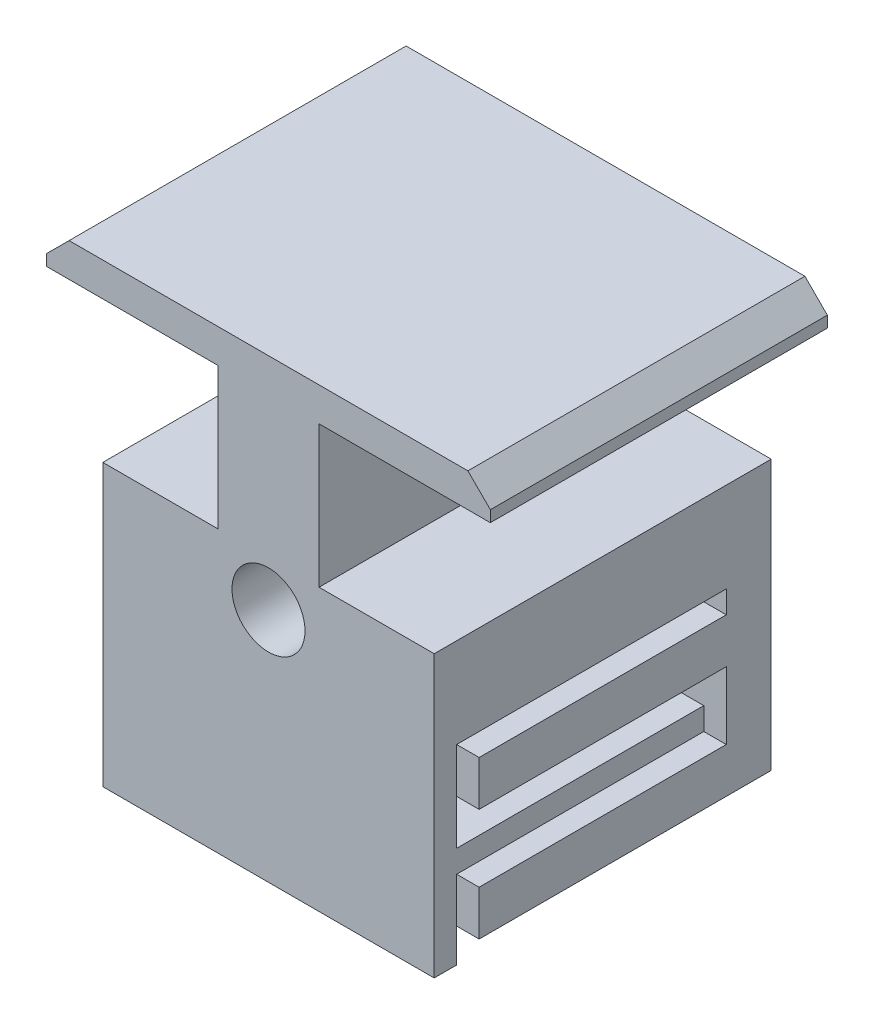
from build123d import *

# Parameters (mm, degrees)
BOSS_EXTRUDE1_DEPTH          = 30
SKETCH2_R                    = 3.25
CUT_EXTRUDE1_DEPTH           = 36
CUT_EXTRUDE_THIN1_DEPTH      = 62.144173884
CUT_EXTRUDE_THIN1_DEPTH_BACK = 19.25
CHAMFER2_SIZE                = 2


with BuildPart() as part:
    # Sketch1 → Boss-Extrude1 (new body)
    with BuildSketch(Plane.XY):
        Polygon((0, 0), (-10.25, 0), (-15.25, 0), (-15.25, -3), (-10.25, -3), (0, -3), (0, -15.6), (-10.25, -15.6), (-10.25, -40.6), (19.25, -40.6), (19.25, -15.6), (9, -15.6), (9, -3), (19.25, -3), (24.25, -3), (24.25, 0), (19.25, 0), (9, 0), align=None)
    extrude(amount=BOSS_EXTRUDE1_DEPTH)

    # Sketch2 → Cut-Extrude1 (cut)
    with BuildSketch(Plane.XY.offset(30)):
        with Locations((4.5, -19.6)):
            Circle(SKETCH2_R)
    extrude(amount=-CUT_EXTRUDE1_DEPTH, mode=Mode.SUBTRACT)

    # Sketch3 → Cut-Extrude-Thin1 (cut, two sides: drawn at the far end of the back side and taken through both)
    with BuildSketch(Plane(origin=(19.25, 0, 0), x_dir=(0, 0, -1), z_dir=(1, 0, 0)).offset(-CUT_EXTRUDE_THIN1_DEPTH_BACK)):
        Polygon((0, -39.6), (-26, -39.6), (-26, -35.6), (-4, -35.6), (-4, -29.6), (-26, -29.6), (-26, -25.6), (-4, -25.6), (-4, -23.6), (-28, -23.6), (-28, -31.6), (-6, -31.6), (-6, -33.6), (-28, -33.6), (-28, -41.6), (0, -41.6), align=None)
    extrude(amount=CUT_EXTRUDE_THIN1_DEPTH + CUT_EXTRUDE_THIN1_DEPTH_BACK, mode=Mode.SUBTRACT)

    # Chamfer2
    chamfer2_edges = [part.edges().sort_by_distance(p)[0] for p in [
        (24.25, 0, 15),
        (-15.25, 0, 15),
    ]]
    chamfer(chamfer2_edges, length=CHAMFER2_SIZE)


solid = part.part
